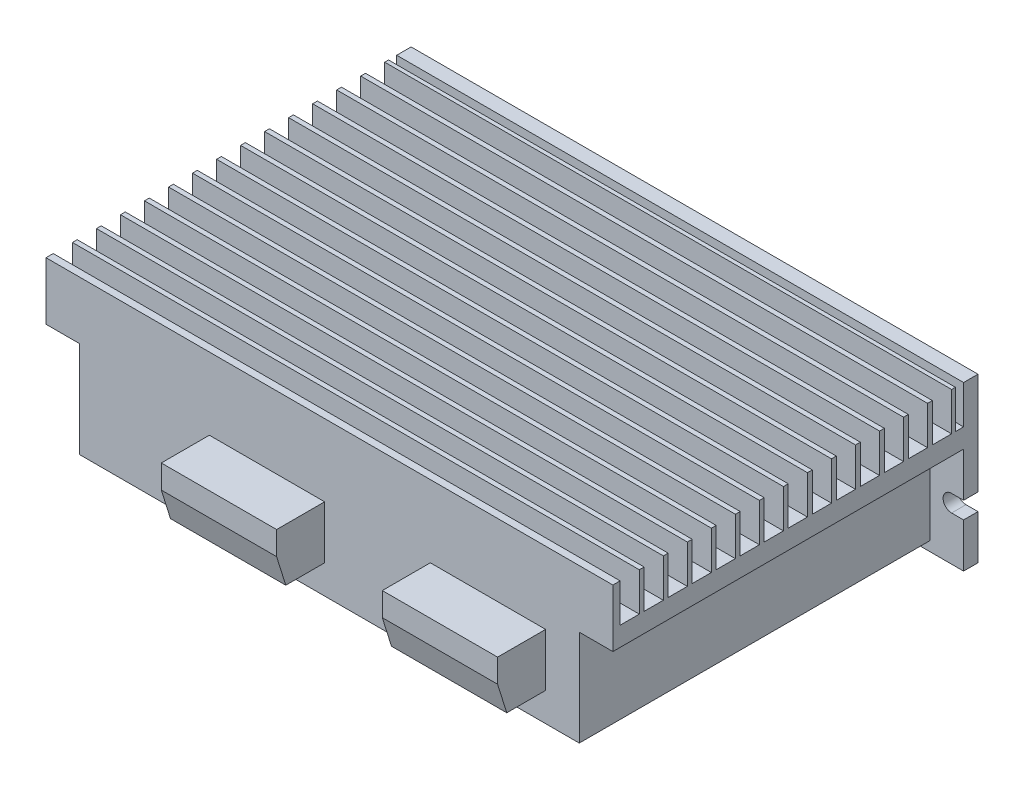
from build123d import *

# Parameters (mm, degrees)
EXTRUDE_1_DEPTH     = 73
SKETCH_2_W          = 118
SKETCH_2_H          = 34
EXTRUDE_2_DEPTH     = 3
SKETCH_3_W          = 4
SKETCH_3_H          = 8
SKETCH_3_W_2        = 1.701544984
CUT_EXTRUDE_1_DEPTH = 122
SKETCH_4_W          = 24
SKETCH_4_H          = 11
EXTRUDE_3_DEPTH     = 10
CUT_EXTRUDE_2_DEPTH = 72
CUT_EXTRUDE_3_DEPTH = 5
CHAMFER_1_SIZE      = 2


with BuildPart() as part:
    # Эскиз1 → Бобышка-Вытянуть1 (new body)
    with BuildSketch(Plane.XY):
        Polygon((-49.206262386, -23.793189369), (54.793737614, -23.793189369), (54.793737614, -1.793189369), (61.793737614, -1.793189369), (61.793737614, 10.206810631), (-56.206262386, 10.206810631), (-56.206262386, -1.793189369), (-49.206262386, -1.793189369), align=None)
    extrude(amount=EXTRUDE_1_DEPTH)

    # Эскиз2 → Бобышка-Вытянуть2 (add)
    with BuildSketch(Plane(origin=(0, 0, 0), x_dir=(-1, 0, 0), z_dir=(0, 0, -1))):
        with Locations((-2.793737614, -6.793189369)):
            Rectangle(SKETCH_2_W, SKETCH_2_H)
    extrude(amount=EXTRUDE_2_DEPTH)

    # Эскиз3 → Вырез-Вытянуть1 (cut)
    with BuildSketch(Plane(origin=(61.793737614, 0, 0), x_dir=(0, 0, -1), z_dir=(1, 0, 0))):
        with Locations((-69.5, 6.206810631)):
            Rectangle(SKETCH_3_W, SKETCH_3_H)
        with Locations((-64.5, 6.206810631)):
            Rectangle(SKETCH_3_W, SKETCH_3_H)
        with Locations((-59.5, 6.206810631)):
            Rectangle(SKETCH_3_W, SKETCH_3_H)
        with Locations((-54.5, 6.206810631)):
            Rectangle(SKETCH_3_W, SKETCH_3_H)
        with Locations((-49.5, 6.206810631)):
            Rectangle(SKETCH_3_W, SKETCH_3_H)
        with Locations((-44.5, 6.206810631)):
            Rectangle(SKETCH_3_W, SKETCH_3_H)
        with Locations((-39.5, 6.206810631)):
            Rectangle(SKETCH_3_W, SKETCH_3_H)
        with Locations((-34.5, 6.206810631)):
            Rectangle(SKETCH_3_W, SKETCH_3_H)
        with Locations((-29.5, 6.206810631)):
            Rectangle(SKETCH_3_W, SKETCH_3_H)
        with Locations((-24.5, 6.206810631)):
            Rectangle(SKETCH_3_W, SKETCH_3_H)
        with Locations((-19.5, 6.206810631)):
            Rectangle(SKETCH_3_W, SKETCH_3_H)
        with Locations((-14.5, 6.206810631)):
            Rectangle(SKETCH_3_W, SKETCH_3_H)
        with Locations((-9.5, 6.206810631)):
            Rectangle(SKETCH_3_W, SKETCH_3_H)
        with Locations((-4.5, 6.206810631)):
            Rectangle(SKETCH_3_W, SKETCH_3_H)
        with Locations((-0.850772492, 6.206810631)):
            Rectangle(SKETCH_3_W_2, SKETCH_3_H)
    extrude(amount=-CUT_EXTRUDE_1_DEPTH, mode=Mode.SUBTRACT)

    # Эскиз4 → Бобышка-Вытянуть3 (add)
    with BuildSketch(Plane.XY.offset(73)):
        with Locations((35.793737614, -10.293189369)):
            Rectangle(SKETCH_4_W, SKETCH_4_H)
        with Locations((-10.206262386, -10.293189369)):
            Rectangle(SKETCH_4_W, SKETCH_4_H)
    extrude(amount=EXTRUDE_3_DEPTH)

    # Эскиз5 → Вырез-Вытянуть2 (cut)
    with BuildSketch(Plane.ZY.offset(22.206262386)):
        Polygon((83, -4.793189369), (83, -9.681423082), (81.084531501, -15.793189369), (84.818796285, -15.793189369), (84.818796285, -4.793189369), align=None)
    extrude(amount=-CUT_EXTRUDE_2_DEPTH, mode=Mode.SUBTRACT)

    # Эскиз6 → Вырез-Вытянуть3 (cut)
    with BuildSketch(Plane(origin=(0, 0, -3), x_dir=(-1, 0, 0), z_dir=(0, 0, -1))):
        with BuildLine():
            Line((-59.293737614, -11.024578472), (-61.793737614, -11.024578472))
            Line((-61.793737614, -11.024578472), (-61.793737614, -14.561800266))
            Line((-61.793737614, -14.561800266), (-59.293737614, -14.561800266))
            ThreePointArc((-59.293737614, -14.561800266), (-57.525126717, -12.793189369), (-59.293737614, -11.024578472))
        make_face()
        with BuildLine():
            Line((53.706262386, -10.764633874), (56.206262386, -10.764633874))
            Line((56.206262386, -10.764633874), (56.206262386, -14.821744863))
            Line((56.206262386, -14.821744863), (53.706262386, -14.821744863))
            ThreePointArc((53.706262386, -14.821744863), (51.677706891, -12.793189369), (53.706262386, -10.764633874))
        make_face()
    extrude(amount=-CUT_EXTRUDE_3_DEPTH, mode=Mode.SUBTRACT)

    # Фаска1
    chamfer_1_edges = [part.edges().sort_by_distance(p)[0] for p in [
        (54.793737614, -23.793189369, 36.5),
        (2.793737614, -23.793189369, 73),
        (-49.206262386, -23.793189369, 36.5),
    ]]
    chamfer(chamfer_1_edges, length=CHAMFER_1_SIZE)


solid = part.part
